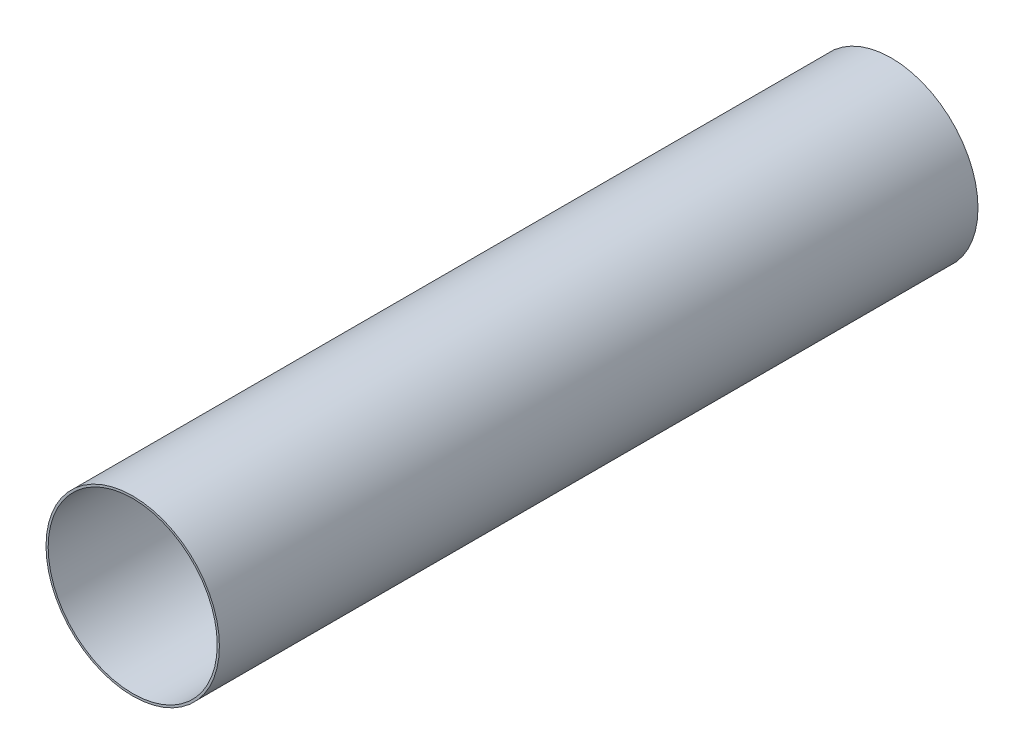
from build123d import *

# Parameters (mm, degrees)
SKETCH1_R           = 80
SKETCH1_R_2         = 78
BOSS_EXTRUDE1_DEPTH = 700


with BuildPart() as part:
    # Sketch1 → Boss-Extrude1 (new body)
    with BuildSketch(Plane.XY):
        Circle(SKETCH1_R)
        Circle(SKETCH1_R_2, mode=Mode.SUBTRACT)
    extrude(amount=BOSS_EXTRUDE1_DEPTH)


solid = part.part
